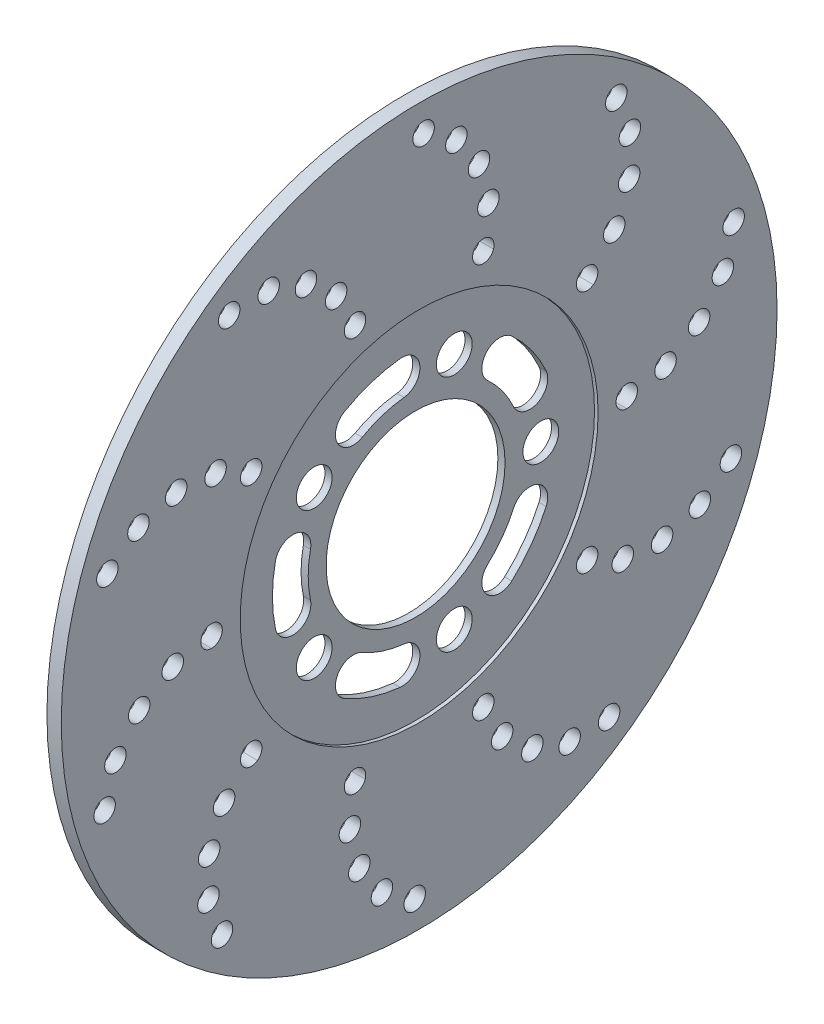
from build123d import *

# Parameters (mm, degrees)
SKETCH1_R           = 100
SKETCH1_R_2         = 50
BOSS_EXTRUDE1_DEPTH = 2
SKETCH1_3_R         = 50
SKETCH1_3_R_2       = 25
BOSS_EXTRUDE2_DEPTH = 1
SKETCH1_4_R         = 5
CUT_EXTRUDE1_DEPTH  = 142.435497666
CIRPATTERN1_COUNT   = 5
SKETCH2_R           = 3
CUT_EXTRUDE2_DEPTH  = 142.477913471
CIRPATTERN2_COUNT   = 10


with BuildPart() as part:
    # Sketch1 → Boss-Extrude1 (new, symmetric)
    with BuildSketch(Plane.YZ):
        Circle(SKETCH1_R)
        Circle(SKETCH1_R_2, mode=Mode.SUBTRACT)
    extrude(amount=BOSS_EXTRUDE1_DEPTH, both=True)

    # Sketch1<3> → Boss-Extrude2 (add, symmetric)
    with BuildSketch(Plane.YZ):
        Circle(SKETCH1_3_R)
        Circle(SKETCH1_3_R_2, mode=Mode.SUBTRACT)
    extrude(amount=BOSS_EXTRUDE2_DEPTH, both=True)

    # Sketch1<4> → Cut-Extrude1 (cut, symmetric)
    with BuildSketch(Plane.YZ):
        with Locations((0, -35)):
            Circle(SKETCH1_4_R)
        with BuildLine():
            ThreePointArc((-6.128110462, 29.367435403), (0, 30), (6.128110462, 29.367435403))
            ThreePointArc((6.128110462, 29.367435403), (12.044034772, 33.240656227), (8.170813949, 39.156580538))
            ThreePointArc((8.170813949, 39.156580538), (0, 40), (-8.170813949, 39.156580538))
            ThreePointArc((-8.170813949, 39.156580538), (-12.044034772, 33.240656227), (-6.128110462, 29.367435403))
        make_face()
    cut_extrude1 = extrude(amount=CUT_EXTRUDE1_DEPTH, both=True, mode=Mode.SUBTRACT)

    # CirPattern1: Cut-Extrude1 ×5 about axis
    cirpattern1_axis = Axis((1, 0, 0), (1, 0, 0))
    for i in range(1, CIRPATTERN1_COUNT):
        add(cut_extrude1.rotate(cirpattern1_axis, i * 360 / CIRPATTERN1_COUNT), mode=Mode.SUBTRACT)

    # Sketch2 → Cut-Extrude2 (cut, symmetric)
    with BuildSketch(Plane.YZ.offset(2)):
        with BuildLine():
            ThreePointArc((3, 58), (0.00012401, 60.999999997), (-2.99999999, 58.000248019))
            ThreePointArc((-2.99999999, 58.000248019), (-0.000124015, 55.000551153), (2.999999944, 58))
        make_face()
        with Locations((-27.245072384, 87.873238422)):
            Circle(SKETCH2_R)
        with Locations((-16.636821514, 84.859364489)):
            Circle(SKETCH2_R)
        with Locations((-7.834358076, 78.215942177)):
            Circle(SKETCH2_R)
        with Locations((-2.027172867, 68.840707643)):
            Circle(SKETCH2_R)
    cut_extrude2 = extrude(amount=CUT_EXTRUDE2_DEPTH, both=True, mode=Mode.SUBTRACT)

    # CirPattern2: Cut-Extrude2 ×10 about axis
    cirpattern2_axis = Axis((2, 0, 0), (1, 0, 0))
    for i in range(1, CIRPATTERN2_COUNT):
        add(cut_extrude2.rotate(cirpattern2_axis, i * 360 / CIRPATTERN2_COUNT), mode=Mode.SUBTRACT)


solid = part.part
